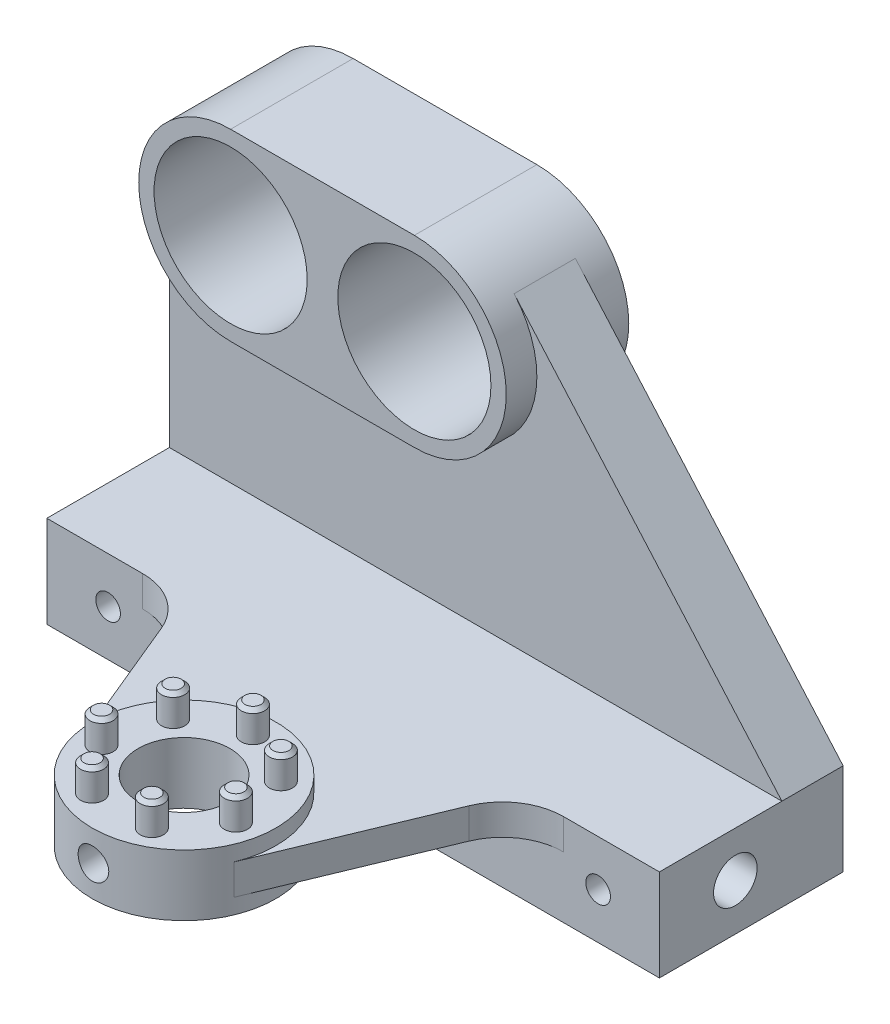
from build123d import *

# Parameters (mm, degrees)
SKETCH1_W                    = 127
SKETCH1_H                    = 38.1
BOSS_EXTRUDE1_DEPTH          = 19.05
BOSS_EXTRUDE2_DEPTH          = 6.35
FILLET1_R                    = 12.7
SKETCH3_R                    = 19.05
BOSS_EXTRUDE3_DEPTH          = 6.35
BOSS_EXTRUDE4_DEPTH          = 12.7
BOSS_EXTRUDE6_DEPTH          = 12.7
F_3_8_1_25_DIAMETER_HOLE1_D  = 31.75
F_1_4_20_TAPPED_HOLE1_D      = 5.1054
SKETCH11_R                   = 3.175
CUT_EXTRUDE1_DEPTH           = 19.05
F_1_4_0_356_DIAMETER_HOLE1_D = 9.0424
F_1_4_0_75_DIAMETER_HOLE1_D  = 19.05
SKETCH16_R                   = 2.413
BOSS_EXTRUDE7_DEPTH          = 6.35
CHAMFER1_SIZE                = 0.762


with BuildPart() as part:
    # Sketch1 → Boss-Extrude1 (new body)
    with BuildSketch(Plane(origin=(0, 0, 0), x_dir=(1, 0, 0), z_dir=(0, 1, 0))):
        with Locations((63.5, 19.05)):
            Rectangle(SKETCH1_W, SKETCH1_H)
    extrude(amount=-BOSS_EXTRUDE1_DEPTH)

    # Sketch2 → Boss-Extrude2 (add)
    with BuildSketch(Plane(origin=(0, 0, 0), x_dir=(1, 0, 0), z_dir=(0, 1, 0))):
        with BuildLine():
            Line((28.361415, 0), (98.638585, 0))
            Line((98.638585, 0), (81.099905, -42.342119))
            ThreePointArc((81.099905, -42.342119), (63.5, -54.102), (45.900095, -42.342119))
            Line((45.900095, -42.342119), (28.361415, 0))
        make_face()
    extrude(amount=-BOSS_EXTRUDE2_DEPTH)

    # Fillet1
    fillet1_edges = [part.edges().sort_by_distance(p)[0] for p in [
        (28.361415, -3.175, 0),
        (98.638585, -3.175, 0),
    ]]
    fillet(fillet1_edges, radius=FILLET1_R)

    # Sketch3 → Boss-Extrude3 (add, symmetric)
    with BuildSketch(Plane(origin=(0, -3.175, 0), x_dir=(1, 0, 0), z_dir=(0, 1, 0))):
        with Locations(Location((63.5, -35.052, 0), (0, 0, 270))):
            Circle(SKETCH3_R)
    extrude(amount=BOSS_EXTRUDE3_DEPTH, both=True)

    # Sketch4 → Boss-Extrude4 (add)
    with BuildSketch(Plane.XY.offset(-38.1)):
        with BuildLine():
            Line((0, 0), (0, 50.8))
            ThreePointArc((0, 50.8), (5.579616, 64.270384), (19.05, 69.85))
            Line((19.05, 69.85), (57.15, 69.85))
            ThreePointArc((57.15, 69.85), (65.01503, 68.150614), (71.476835, 63.355648))
            Line((71.476835, 63.355648), (127, 0))
            Line((127, 0), (0, 0))
        make_face()
    extrude(amount=BOSS_EXTRUDE4_DEPTH)

    # Sketch7 → Boss-Extrude6 (add, symmetric)
    with BuildSketch(Plane.XY.offset(-31.75)):
        with BuildLine():
            Line((19.05, 69.85), (57.15, 69.85))
            ThreePointArc((57.15, 69.85), (76.2, 50.8), (57.15, 31.75))
            Line((57.15, 31.75), (19.05, 31.75))
            ThreePointArc((19.05, 31.75), (0, 50.8), (19.05, 69.85))
        make_face()
    extrude(amount=BOSS_EXTRUDE6_DEPTH, both=True)

    # 3/8 (1.25) Diameter Hole1 (through all)
    with Locations(Plane(origin=(19.05, 50.8, -19.05), x_dir=(1, 0, 0), z_dir=(0, 0, 1))):
        with Locations((0, 0), (38.1, 0)):
            Hole(F_3_8_1_25_DIAMETER_HOLE1_D / 2)

    # 1/4-20 Tapped Hole1 (through all)
    with Locations(Plane(origin=(12.7, -9.525, 0), x_dir=(1, 0, 0), z_dir=(0, 0, 1))):
        with Locations((0, 0), (101.6, 0)):
            Hole(F_1_4_20_TAPPED_HOLE1_D / 2)

    # Sketch11 → Cut-Extrude1 (cut)
    with BuildSketch(Plane.XY.offset(54.61)):
        with Locations((63.5, -3.175)):
            Circle(SKETCH11_R)
    extrude(amount=-CUT_EXTRUDE1_DEPTH, mode=Mode.SUBTRACT)

    # 1/4 (0.356) Diameter Hole1 (through all)
    with Locations(Plane(origin=(127, -9.398, -15.748), x_dir=(0, 0, 1), z_dir=(1, 0, 0))):
        with Locations((0, 0)):
            Hole(F_1_4_0_356_DIAMETER_HOLE1_D / 2)

    # 1/4 (0.75) Diameter Hole1 (through all)
    with Locations(Plane(origin=(63.5, 3.175, 35.052), x_dir=(0, 0, 1), z_dir=(0, 1, 0))):
        with Locations((0, 0)):
            Hole(F_1_4_0_75_DIAMETER_HOLE1_D / 2)

    # Sketch16 → Boss-Extrude7 (add)
    with BuildSketch(Plane(origin=(0, 3.175, 0), x_dir=(1, 0, 0), z_dir=(0, 1, 0))):
        with Locations(Location((63.5, -20.7645, 0), (0, 0, 270))):
            Circle(SKETCH16_R)
        with Locations(Location((74.670417, -26.143889, 0), (0, 0, 270))):
            Circle(SKETCH16_R)
        with Locations(Location((77.429283, -38.231268, 0), (0, 0, 270))):
            Circle(SKETCH16_R)
        with Locations(Location((69.699114, -47.924593, 0), (0, 0, 270))):
            Circle(SKETCH16_R)
        with Locations(Location((57.300886, -47.924593, 0), (0, 0, 270))):
            Circle(SKETCH16_R)
        with Locations(Location((49.570717, -38.231268, 0), (0, 0, 270))):
            Circle(SKETCH16_R)
        with Locations(Location((52.329583, -26.143889, 0), (0, 0, 270))):
            Circle(SKETCH16_R)
    extrude(amount=BOSS_EXTRUDE7_DEPTH)

    # Chamfer1
    chamfer1_edges = [part.edges().sort_by_distance(p)[0] for p in [
        (63.5, 9.525, 18.3515),
        (74.670417, 9.525, 23.730889),
        (77.429283, 9.525, 35.818268),
        (69.699114, 9.525, 45.511593),
        (57.300886, 9.525, 45.511593),
        (49.570717, 9.525, 35.818268),
        (52.329583, 9.525, 23.730889),
    ]]
    chamfer(chamfer1_edges, length=CHAMFER1_SIZE)


solid = part.part
